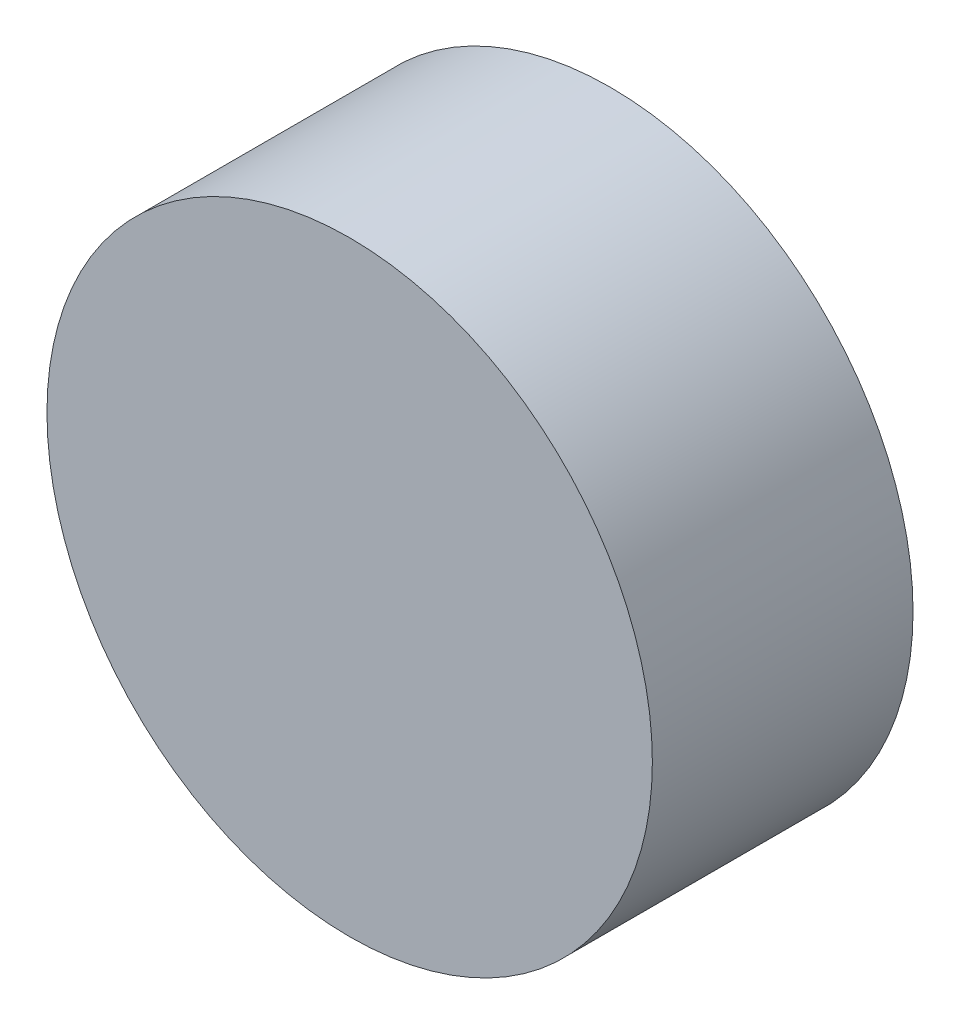
from build123d import *


with BuildPart() as part:
    # Skizze1 → Rotation2 (revolve)
    with BuildSketch(Plane(origin=(0, 0, 0), x_dir=(1, 0, 0), z_dir=(0, 1, 0)), mode=Mode.PRIVATE) as rotation2_sk:
        Polygon((0.00340061, -8.034840547), (0.00340061, -10.034840547), (20.90540061, -10.034840547), (20.90540061, 7.965159453), (18.90540061, 7.965159453), (18.90540061, -2.034840547), (17.40540061, -2.034840547), (17.40540061, -4.034840547), (18.90540061, -4.034840547), (18.90540061, -8.034840547), align=None)
    revolve(rotation2_sk.sketch.rotate(Axis((0.00340061, 0, 8.034840547), (0, 0, 1)), 180), axis=Axis((0.00340061, 0, 8.034840547), (0, 0, 1)))


solid = part.part
